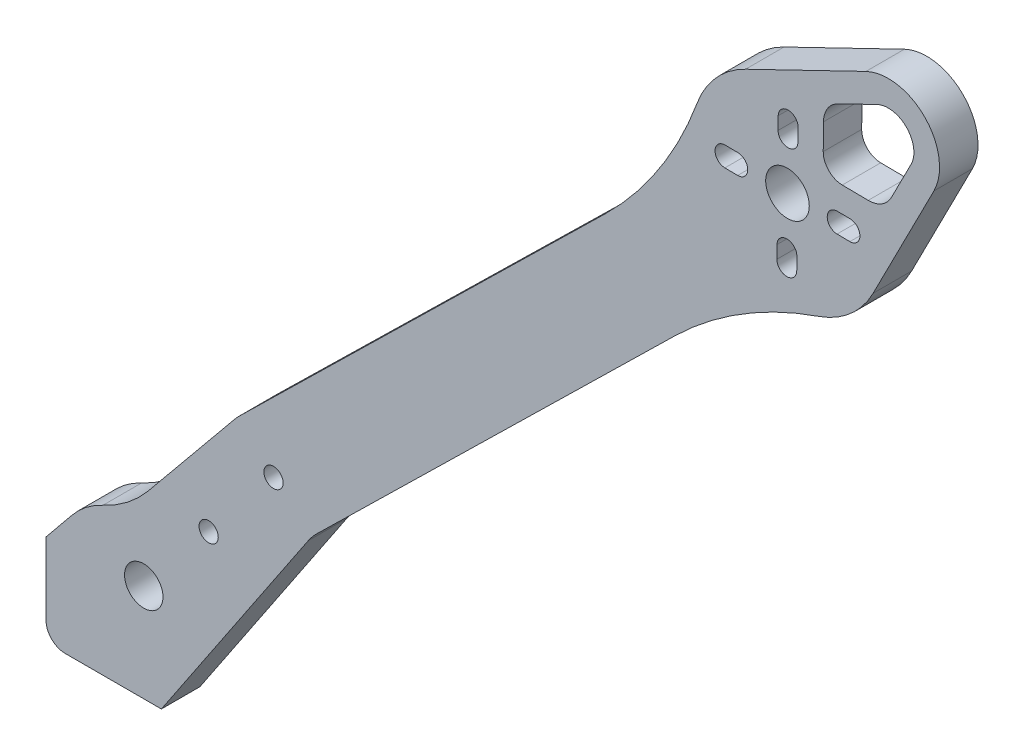
from build123d import *

# Parameters (mm, degrees)
CROQUIS1_R              = 1.5
CROQUIS1_R_2            = 3
CROQUIS1_R_3            = 3.4
SALIENTE_EXTRUIR1_DEPTH = 6


with BuildPart() as part:
    # Croquis1 → Saliente-Extruir1 (new body)
    with BuildSketch(Plane.XY):
        with BuildLine():
            Line((8.1e-08, 14.249999874), (8.1e-08, 2.999999874))
            ThreePointArc((8.1e-08, 2.999999874), (0.878679737, 0.87867953), (3.000000081, -1.26e-07))
            Line((3.000000081, -1.26e-07), (18.000000081, -1.26e-07))
            Line((18.000000081, -1.26e-07), (40.911193324, 34.196329551))
            ThreePointArc((40.911193324, 34.196329551), (41.527076457, 35.020483475), (42.224381081, 35.776993874))
            Line((42.224381081, 35.776993874), (98.096843081, 90.459473874))
            ThreePointArc((98.096843081, 90.459473874), (108.550843923, 98.63680641), (120.546851363, 104.315776961))
            ThreePointArc((120.546851363, 104.315776961), (125.500442362, 107.172433842), (129.025046114, 111.675290792))
            Line((129.025046114, 111.675290792), (138.514418989, 130.248169023))
            ThreePointArc((138.514418989, 130.248169023), (137.107819922, 139.483655494), (127.90475, 141.088721))
            Line((127.90475, 141.088721), (109.131917, 132.001327))
            ThreePointArc((109.131917, 132.001327), (104.554236665, 128.574463552), (101.591616002, 123.683509744))
            ThreePointArc((101.591616002, 123.683509744), (95.655747756, 111.812521161), (87.255287964, 101.536959032))
            Line((87.255287964, 101.536959032), (30.072463964, 45.572027032))
            ThreePointArc((30.072463964, 45.572027032), (29.779023988, 45.268761189), (29.502525894, 44.949972866))
            Line((29.502525894, 44.949972866), (15.949120522, 28.43588954))
            ThreePointArc((15.949120522, 28.43588954), (12.726828906, 25.305121034), (8.887000234, 22.972613701))
            ThreePointArc((8.887000234, 22.972613701), (6.271558617, 21.381766549), (4.079708958, 19.244683353))
            Line((4.079708958, 19.244683353), (8.1e-08, 14.249999874))
        make_face()
        with Locations((25.371621, 27.641642)):
            Circle(CROQUIS1_R, mode=Mode.SUBTRACT)
        with Locations((35.493241781, 40.03328422)):
            Circle(CROQUIS1_R, mode=Mode.SUBTRACT)
        with Locations((15.25, 15.25)):
            Circle(CROQUIS1_R_2, mode=Mode.SUBTRACT)
        with Locations((115.667525989, 118.500000023)):
            Circle(CROQUIS1_R_3, mode=Mode.SUBTRACT)
        with BuildLine():
            Line((105.901407198, 117.055029782), (107.901292, 117.033504))
            ThreePointArc((107.901292, 117.033504), (109.4678845, 118.5667315), (107.934657, 120.133324))
            Line((107.934657, 120.133324), (105.934773, 120.15485))
            ThreePointArc((105.934773, 120.15485), (104.368758386, 118.621616566), (105.901407198, 117.055029782))
        make_face(mode=Mode.SUBTRACT)
        with BuildLine():
            Line((114.012675, 108.767248), (114.034201, 110.767132))
            ThreePointArc((114.034201, 110.767132), (115.6007945, 112.3003595), (117.134022, 110.733766))
            Line((117.134022, 110.733766), (117.112495218, 108.733882198))
            ThreePointArc((117.112495218, 108.733882198), (115.545908434, 107.201233386), (114.012675, 108.767248))
        make_face(mode=Mode.SUBTRACT)
        with BuildLine():
            Line((124.211353692, 123.893635573), (128.262273986, 123.850032801))
            ThreePointArc((128.262273986, 123.850032801), (130.375033742, 124.426891571), (131.867331288, 126.029878739))
            Line((131.867331288, 126.029878739), (134.952413288, 132.068090739))
            ThreePointArc((134.952413288, 132.068090739), (134.24911451, 136.685834372), (129.647579323, 137.48836746))
            Line((129.647579323, 137.48836746), (123.544360208, 134.533971661))
            ThreePointArc((123.544360208, 134.533971661), (121.909622476, 133.076524245), (121.287419986, 130.976670801))
            Line((121.287419986, 130.976670801), (121.243816986, 126.925750801))
            ThreePointArc((121.243816986, 126.925750801), (122.099613791, 124.795096288), (124.211353692, 123.893635573))
        make_face(mode=Mode.SUBTRACT)
        with BuildLine():
            Line((125.400278, 116.84515), (123.400394, 116.866676))
            ThreePointArc((123.400394, 116.866676), (121.867759233, 118.43326212), (123.433759, 119.966496))
            Line((123.433759, 119.966496), (125.433643802, 119.944970218))
            ThreePointArc((125.433643802, 119.944970218), (126.96687101, 118.378377208), (125.400278, 116.84515))
        make_face(mode=Mode.SUBTRACT)
        with BuildLine():
            Line((117.322376, 128.232752), (117.30085, 126.232868))
            ThreePointArc((117.30085, 126.232868), (115.734268362, 124.700742507), (114.201029, 126.266234))
            Line((114.201029, 126.266234), (114.222555782, 128.266117802))
            ThreePointArc((114.222555782, 128.266117802), (115.789148792, 129.79934501), (117.322376, 128.232752))
        make_face(mode=Mode.SUBTRACT)
    extrude(amount=SALIENTE_EXTRUIR1_DEPTH)


solid = part.part
